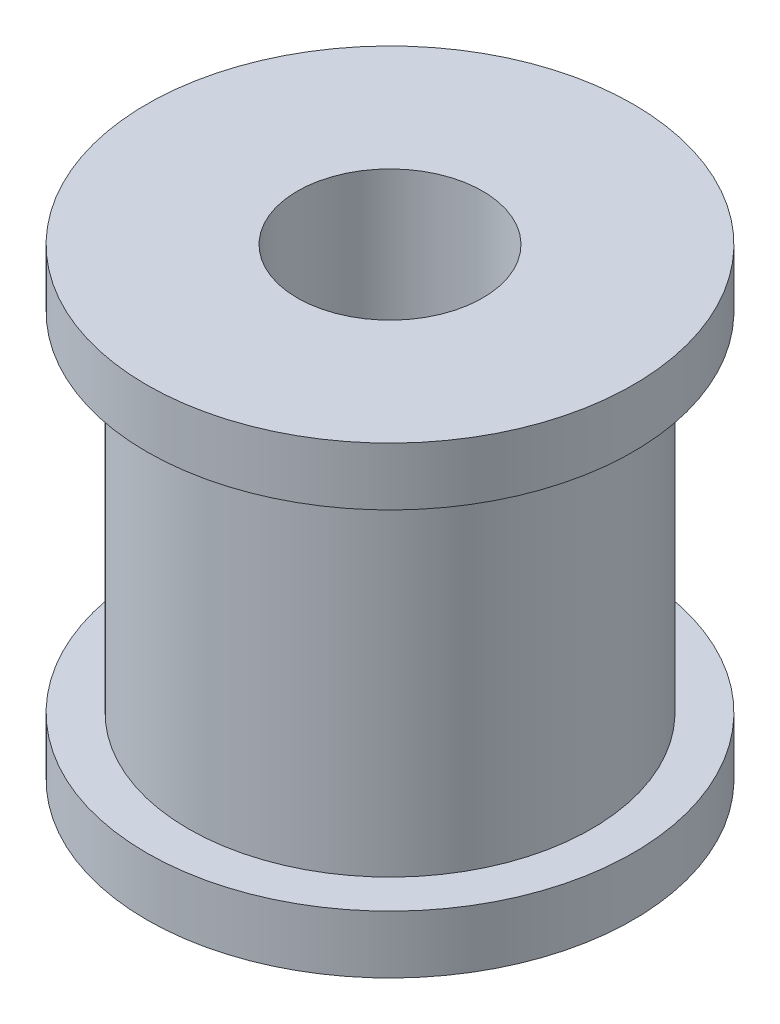
from build123d import *


with BuildPart() as part:
    # Schizzo1 → Rivoluzione1 (revolve)
    with BuildSketch(Plane.XY, mode=Mode.PRIVATE) as rivoluzione1_sk:
        Polygon((4, -7.661290323), (10.5, -7.661290323), (10.5, -5.161290323), (8.7, -5.161290323), (8.7, 9.838709677), (10.5, 9.838709677), (10.5, 12.338709677), (4, 12.338709677), align=None)
    revolve(rivoluzione1_sk.sketch.rotate(Axis((0, 12.338709677, 0), (0, -1, 0)), 90), axis=Axis((0, 12.338709677, 0), (0, -1, 0)))


solid = part.part
